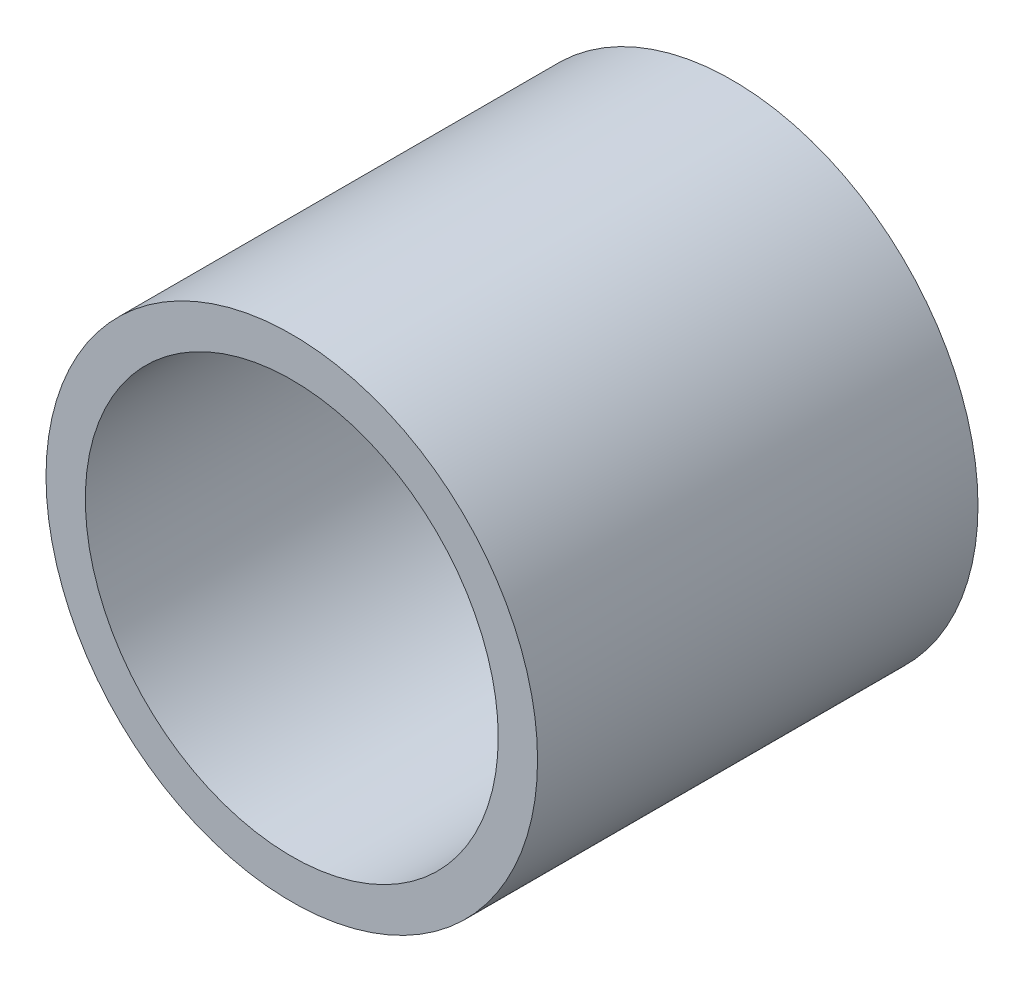
from build123d import *

# Parameters (mm, degrees)
SKETCH1_R           = 15.875
BOSS_EXTRUDE1_DEPTH = 28.448
SHELL1_T            = -2.54


with BuildPart() as part:
    # Sketch1 → Boss-Extrude1 (new body)
    with BuildSketch(Plane.XY):
        Circle(SKETCH1_R)
    extrude(amount=BOSS_EXTRUDE1_DEPTH)

    # Shell1
    shell1_openings = [part.faces().sort_by_distance(p)[0] for p in [
        (0, 0, 28.448),
    ]]
    offset(amount=SHELL1_T, openings=shell1_openings, kind=Kind.INTERSECTION)


solid = part.part
